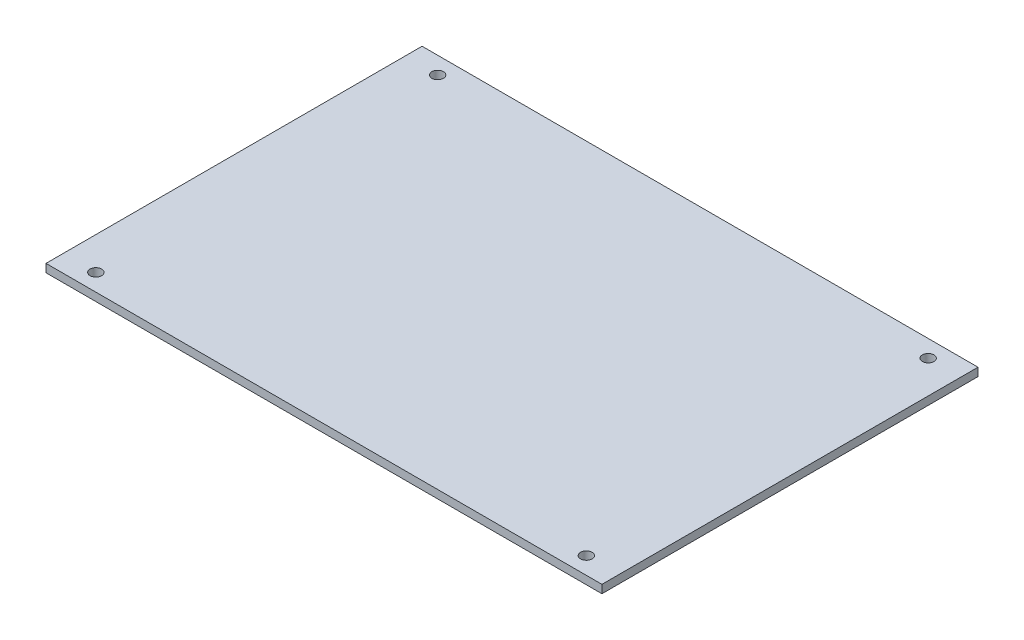
from build123d import *

# Parameters (mm, degrees)
SKETCH1_W                 = 215.9
SKETCH1_H                 = 146.05
BOSS_EXTRUDE1_DEPTH       = 3.175
F_8_CLEARANCE_HOLE2_D     = 4.4958
F_8_CLEARANCE_HOLE2_DEPTH = 12.7
F_8_CLEARANCE_HOLE2_TIP   = 1.350674586


with BuildPart() as part:
    # Sketch1 → Boss-Extrude1 (new body)
    with BuildSketch(Plane(origin=(0, 0, 0), x_dir=(1, 0, 0), z_dir=(0, 1, 0))):
        Rectangle(SKETCH1_W, SKETCH1_H)
    extrude(amount=BOSS_EXTRUDE1_DEPTH)

    # #8 Clearance Hole2
    with Locations(Plane(origin=(0, 3.175, 0), x_dir=(1, 0, 0), z_dir=(0, 1, 0))):
        with Locations((-95.25, 66.3812617), (95.25, 66.3812617), (95.25, -66.3812617), (-95.25, -66.3812617)):
            Hole(F_8_CLEARANCE_HOLE2_D / 2, depth=F_8_CLEARANCE_HOLE2_DEPTH)
            with Locations((0, 0, -(F_8_CLEARANCE_HOLE2_DEPTH + F_8_CLEARANCE_HOLE2_TIP / 2))):  # 118° drill point
                Cone(0, F_8_CLEARANCE_HOLE2_D / 2, F_8_CLEARANCE_HOLE2_TIP, mode=Mode.SUBTRACT)


solid = part.part
